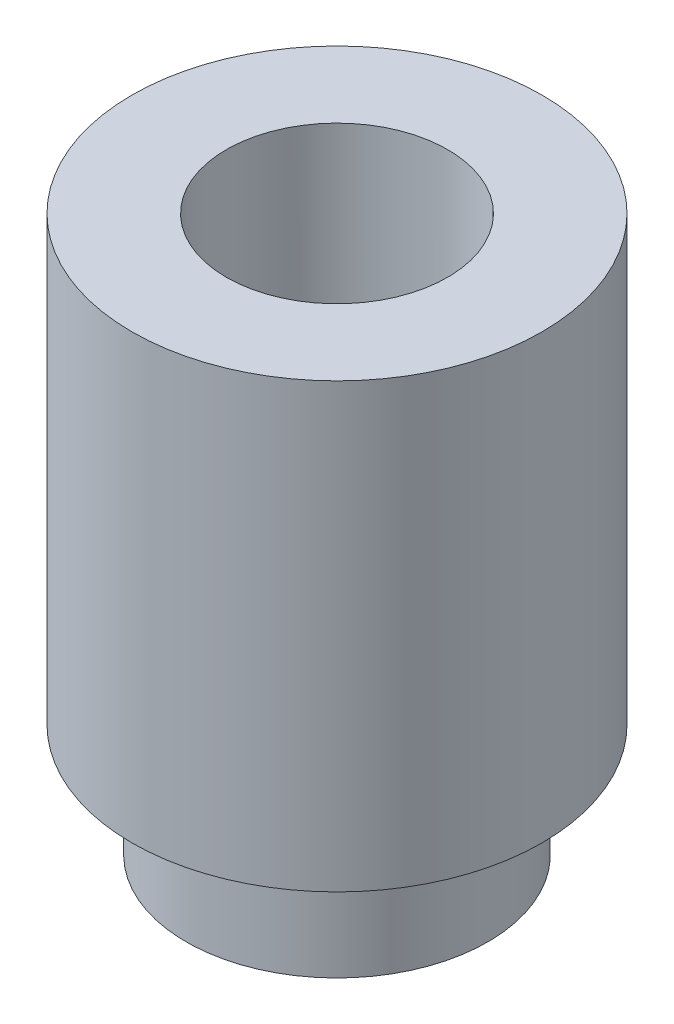
from build123d import *

# Parameters (mm, degrees)
SKETCH_1_R          = 2.78
EXTRUDE_1_DEPTH     = 6
SKETCH_2_R          = 2.045
EXTRUDE_2_DEPTH     = 1.53
CUT_EXTRUDE_1_REACH = 10.495
SKETCH_3_R          = 1.5


with BuildPart() as part:
    # 草图1 → 凸台-拉伸1 (new body)
    with BuildSketch(Plane(origin=(0, 0, 0), x_dir=(1, 0, 0), z_dir=(0, 1, 0))):
        with Locations(Location((0, 0, 0), (0, 0, 270))):
            Circle(SKETCH_1_R)
    extrude(amount=EXTRUDE_1_DEPTH)

    # 草图2 → 凸台-拉伸2 (add)
    with BuildSketch(Plane.XZ):
        with Locations(Location((0, 0, 0), (0, 0, 270))):
            Circle(SKETCH_2_R)
    extrude(amount=EXTRUDE_2_DEPTH)

    # 草图3 → 切除-拉伸1 (cut, up to next)
    with BuildSketch(Plane(origin=(0, 6, 0), x_dir=(1, 0, 0), z_dir=(0, 1, 0)), mode=Mode.PRIVATE) as cut_extrude_1_sk1:
        with Locations(Location((0, 0, 0), (0, 0, 270))):
            Circle(SKETCH_3_R)
    cut_extrude_1_tool1 = extrude(cut_extrude_1_sk1.sketch, amount=-CUT_EXTRUDE_1_REACH, mode=Mode.PRIVATE) & part.part
    add(cut_extrude_1_tool1.solids().sort_by_distance((0, 6, 0))[0], mode=Mode.SUBTRACT)


solid = part.part
